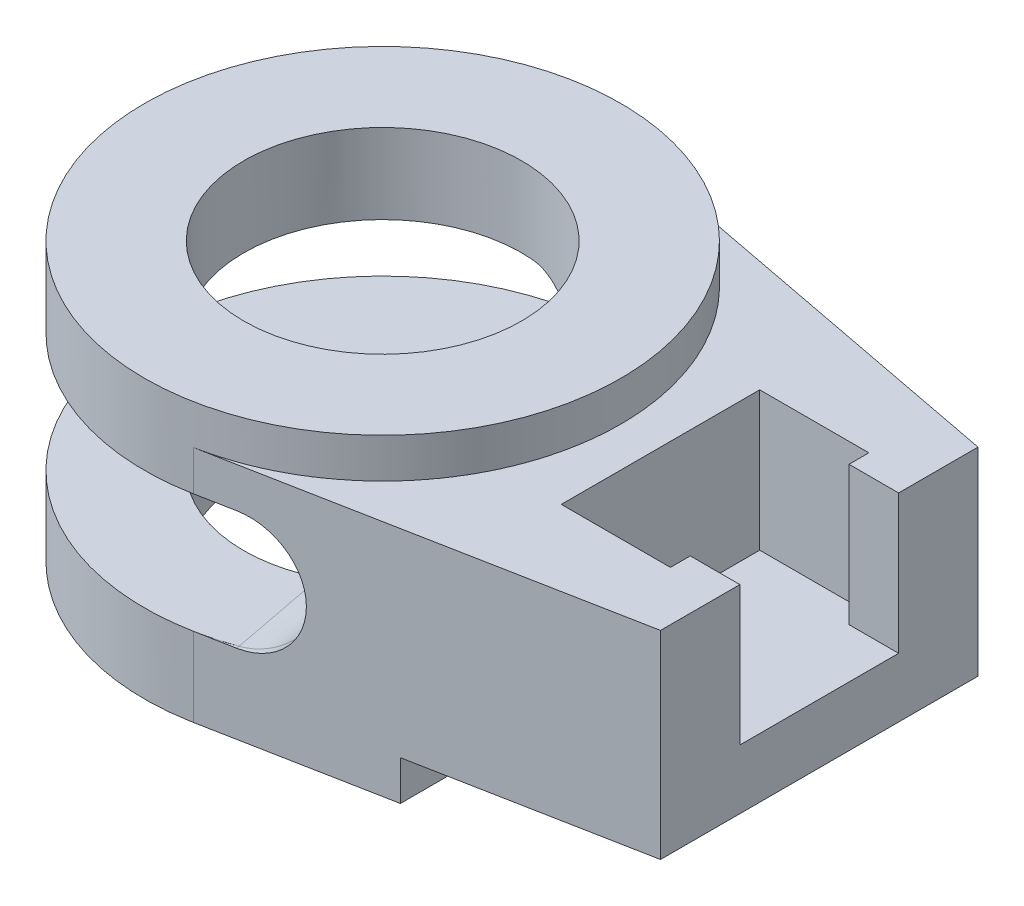
from build123d import *

# Parameters (mm, degrees)
SKETCH_1_R               = 48
SKETCH_1_R_2             = 28
EXTRUDE_1_DEPTH          = 56
EXTRUDE_3_DEPTH          = 56
CUT_EXTRUDE_1_REACH      = 137.73
SKETCH_3_W               = 92.45179213
SKETCH_3_H               = 8
CUT_EXTRUDE_2_DEPTH      = 28
CUT_EXTRUDE_8_DEPTH      = 136.729806001
CUT_EXTRUDE_9_DEPTH      = 115.821600846
CUT_EXTRUDE_9_DEPTH_BACK = 115.821600846
SKETCH_12_W              = 44
SKETCH_12_H              = 8


with BuildPart() as part:
    # 草圖1 → 填料-伸長1 (new body)
    with BuildSketch(Plane(origin=(0, 0, 0), x_dir=(1, 0, 0), z_dir=(0, 1, 0))):
        with Locations(Location((0, 0, 0), (0, 0, 270))):
            Circle(SKETCH_1_R)
        with Locations(Location((0, 0, 0), (0, 0, 270))):
            Circle(SKETCH_1_R_2, mode=Mode.SUBTRACT)
    extrude(amount=EXTRUDE_1_DEPTH)


with BuildPart() as body_2:
    # 草圖2 → 填料-伸長3 (new body)
    with BuildSketch(Plane(origin=(0, 56, 0), x_dir=(1, 0, 0), z_dir=(0, 1, 0))):
        with BuildLine():
            Line((88, 32), (88, -32))
            Line((88, -32), (9.03959037, -47.141126481))
            ThreePointArc((9.03959037, -47.141126481), (48, 0), (9.03959037, 47.141126481))
            Line((9.03959037, 47.141126481), (88, 32))
        make_face()
    extrude(amount=-EXTRUDE_3_DEPTH)

    # 除料-伸長1: up to this plane
    cut_extrude_1_end = Plane(origin=(88, 0, -32), z_dir=(0.18832479938333163, 0, -0.9821068016958379))
    # 草圖3 → 除料-伸長1 (cut, up to the surface)
    with BuildSketch(Plane(origin=(9.03959037, 0, 47.141126481), x_dir=(0.9821068016958379, 0, -0.18832479938333163), z_dir=(0.18832479938333163, 0, 0.9821068016958379)), mode=Mode.PRIVATE) as cut_extrude_1_sk1:
        with Locations((46.225896065, 52)):
            Rectangle(SKETCH_3_W, SKETCH_3_H)
    cut_extrude_1_tool1 = split(extrude(cut_extrude_1_sk1.sketch, amount=-CUT_EXTRUDE_1_REACH, mode=Mode.PRIVATE), bisect_by=cut_extrude_1_end, keep=Keep.BOTH, mode=Mode.PRIVATE)
    add(cut_extrude_1_tool1.solids().sort_by_distance((54.438357, 52, 38.435644))[0], mode=Mode.SUBTRACT)

    # 草圖4 → 除料-伸長2 (cut)
    with BuildSketch(Plane(origin=(0, 48, 0), x_dir=(1, 0, 0), z_dir=(0, 1, 0))):
        Polygon((88, 16), (78, 16), (78, 20), (56, 20), (56, -20), (78, -20), (78, -16), (88, -16), align=None)
    extrude(amount=-CUT_EXTRUDE_2_DEPTH, mode=Mode.SUBTRACT)


with BuildPart() as cut_extrude_8_tool:
    # 草圖5 → 除料-伸長8 (new, through all)
    with BuildSketch(Plane(origin=(9.03959037, 0, 47.141126481), x_dir=(0.9821068016958379, 0, -0.18832479938333163), z_dir=(0.18832479938333163, 0, 0.9821068016958379))):
        with BuildLine():
            Line((-48, 39.917352267), (7.410271533, 39.917352267))
            ThreePointArc((7.410271533, 39.917352267), (19.410271533, 27.917352267), (7.410271533, 15.917352267))
            Line((7.410271533, 15.917352267), (-48, 15.917352267))
            Line((-48, 15.917352267), (-48, 39.917352267))
        make_face()
    extrude(amount=-CUT_EXTRUDE_8_DEPTH)


with BuildPart() as part_1:
    add(part.part)

    # 除料-伸長8: cut by cut_extrude_8_tool
    add(cut_extrude_8_tool.part, mode=Mode.SUBTRACT)


with BuildPart() as body_2_1:
    add(body_2.part)

    # 除料-伸長8: cut by cut_extrude_8_tool
    add(cut_extrude_8_tool.part, mode=Mode.SUBTRACT)


with BuildPart() as cut_extrude_9_tool:
    # 草圖12 → 除料-伸長9 (new, two sides: drawn at the far end of the back side and taken through both)
    with BuildSketch(Plane.XY.offset(-CUT_EXTRUDE_9_DEPTH_BACK)):
        with Locations((66, 4)):
            Rectangle(SKETCH_12_W, SKETCH_12_H)
    extrude(amount=CUT_EXTRUDE_9_DEPTH + CUT_EXTRUDE_9_DEPTH_BACK)


with BuildPart() as part_2:
    add(part_1.part)

    # 除料-伸長9: cut by cut_extrude_9_tool
    add(cut_extrude_9_tool.part, mode=Mode.SUBTRACT)


with BuildPart() as body_2_2:
    add(body_2_1.part)

    # 除料-伸長9: cut by cut_extrude_9_tool
    add(cut_extrude_9_tool.part, mode=Mode.SUBTRACT)


solid = Compound([part_2.part, body_2_2.part])
